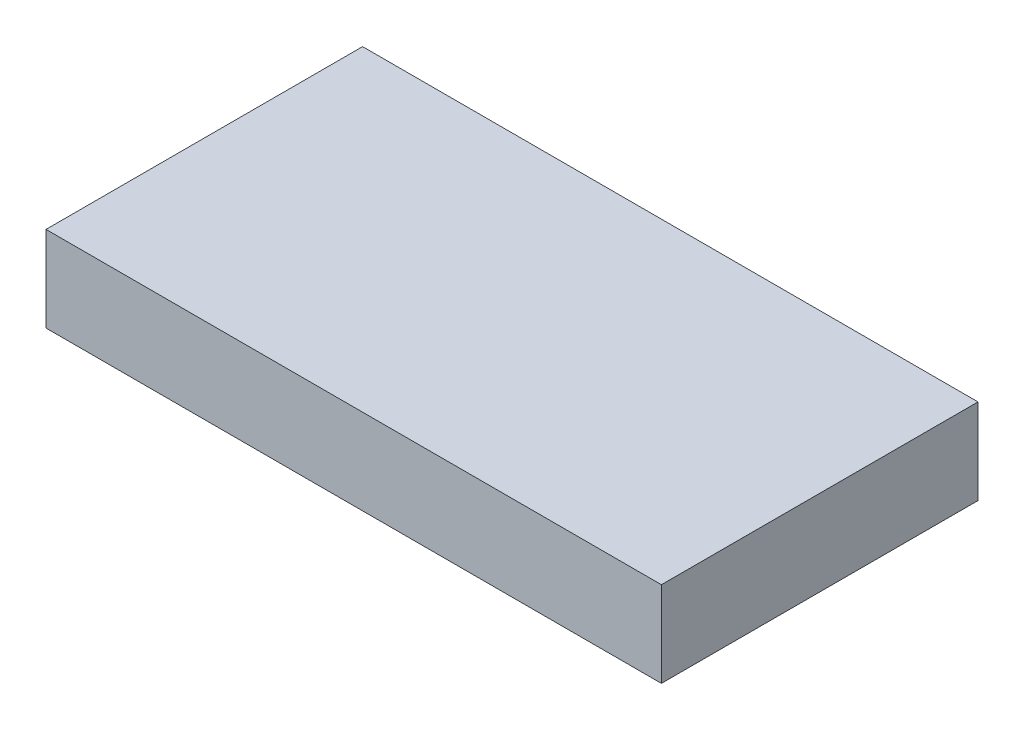
from build123d import *

# Parameters (mm, degrees)
SKETCH1_W           = 228.6
SKETCH1_H           = 117.602
BOSS_EXTRUDE1_DEPTH = 31.75


with BuildPart() as part:
    # Sketch1 → Boss-Extrude1 (new body)
    with BuildSketch(Plane(origin=(0, 0, 0), x_dir=(1, 0, 0), z_dir=(0, 1, 0))):
        with Locations((114.3, 58.801)):
            Rectangle(SKETCH1_W, SKETCH1_H)
    extrude(amount=BOSS_EXTRUDE1_DEPTH)


solid = part.part
